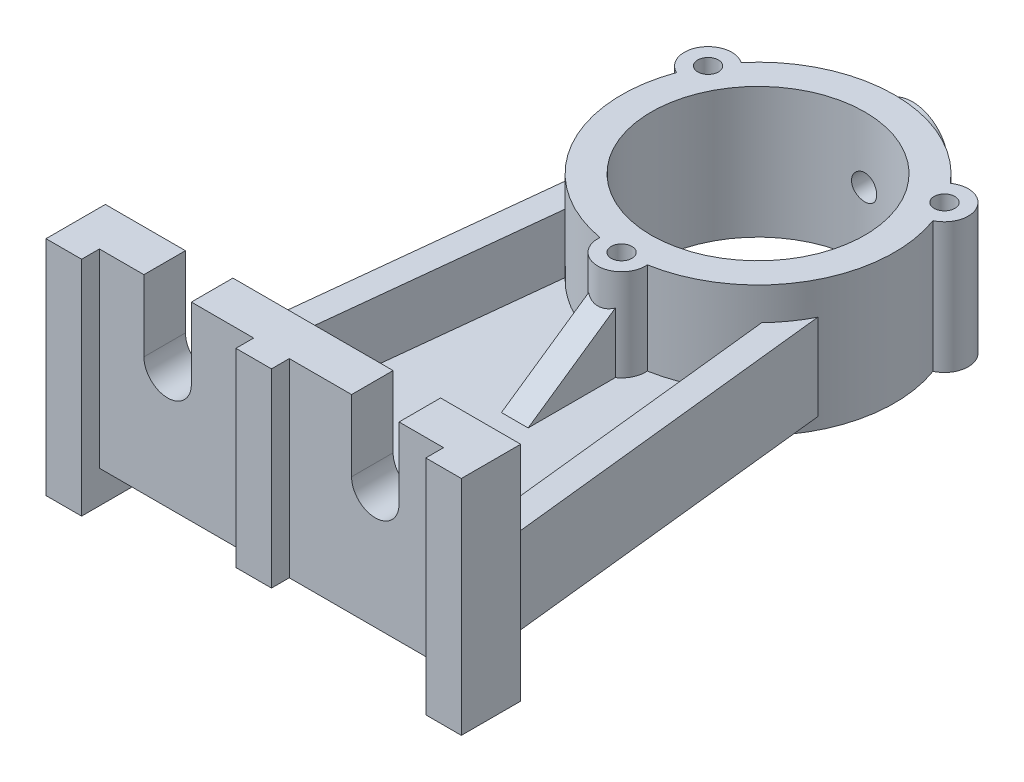
from build123d import *

# Parameters (mm, degrees)
SKETCH_1_R               = 46
EXTRUDE_1_DEPTH          = 44
SKETCH_2_R               = 8
EXTRUDE_2_DEPTH          = 44
SKETCH_3_R               = 3.5
CUT_EXTRUDE_1_DEPTH      = 44
PATTERN_CIRCULAR_1_COUNT = 3
EXTRUDE_START            = -52
EXTRUDE_3_DEPTH          = 44
SKETCH_6_R               = 36
CUT_EXTRUDE_2_DEPTH      = 44
HOLE_WIZARD_M10_1_REACH  = 126.34
HOLE_WIZARD_M10_1_BORE_R = 4.25
EXTRUDE_START_2          = 4
EXTRUDE_4_DEPTH          = 9
EXTRUDE_5_DEPTH          = 20
RIB_1_REACH              = 167.714
SKETCH_11_WALL_W         = 368.62723947
SKETCH_11_WALL_H         = 9
EXTRUDE_START_3          = 170
SKETCH_13_W              = 140
SKETCH_13_H              = 64
EXTRUDE_6_DEPTH          = 20
CUT_EXTRUDE_3_DEPTH      = 227.559043166
SKETCH_15_W              = 52
SKETCH_15_H              = 6
CUT_EXTRUDE_4_DEPTH      = 199.557296554
SKETCH_17_W              = 12
SKETCH_17_H              = 20
EXTRUDE_7_DEPTH          = 11


with BuildPart() as part:
    # 草图1 → 凸台-拉伸1 (new body)
    with BuildSketch(Plane(origin=(0, 0, 0), x_dir=(1, 0, 0), z_dir=(0, 1, 0))):
        with Locations(Location((0, 0, 0), (0, 0, 270))):
            Circle(SKETCH_1_R)
    extrude(amount=EXTRUDE_1_DEPTH)

    # 草图2 → 凸台-拉伸2 (add)
    with BuildSketch(Plane(origin=(0, 44, 0), x_dir=(1, 0, 0), z_dir=(0, 1, 0))):
        with Locations((0, -46)):
            Circle(SKETCH_2_R)
    extrude_2 = extrude(amount=-EXTRUDE_2_DEPTH)

    # 草图3 → 切除-拉伸1 (cut)
    with BuildSketch(Plane(origin=(0, 44, 0), x_dir=(1, 0, 0), z_dir=(0, 1, 0))):
        with Locations(Location((0, -46, 0), (0, 0, 270))):
            Circle(SKETCH_3_R)
    cut_extrude_1 = extrude(amount=-CUT_EXTRUDE_1_DEPTH, mode=Mode.SUBTRACT)

    # 阵列(圆周)1: 凸台-拉伸2, 切除-拉伸1 ×3 about axis
    pattern_circular_1_axis = Axis((0, 0, 0), (0, 1, 0))
    add([extrude_2.rotate(pattern_circular_1_axis, i * 360 / PATTERN_CIRCULAR_1_COUNT) for i in range(1, PATTERN_CIRCULAR_1_COUNT)])
    add([cut_extrude_1.rotate(pattern_circular_1_axis, i * 360 / PATTERN_CIRCULAR_1_COUNT) for i in range(1, PATTERN_CIRCULAR_1_COUNT)], mode=Mode.SUBTRACT)

    # 草图5 → 凸台-拉伸3 (add)
    with BuildSketch(Plane.XY.offset(EXTRUDE_START)):
        with BuildLine():
            Line((-12, 27), (-12, 0))
            Line((-12, 0), (12, 0))
            Line((12, 0), (12, 27))
            ThreePointArc((12, 27), (0, 39), (-12, 27))
        make_face()
    extrude(amount=EXTRUDE_3_DEPTH)

    # 草图6 → 切除-拉伸2 (cut)
    with BuildSketch(Plane(origin=(0, 44, 0), x_dir=(1, 0, 0), z_dir=(0, 1, 0))):
        with Locations(Location((0, 0, 0), (0, 0, 270))):
            Circle(SKETCH_6_R)
    extrude(amount=-CUT_EXTRUDE_2_DEPTH, mode=Mode.SUBTRACT)

    # M10 螺纹孔1 bore → M10 螺纹孔1 (cut, up to next)
    with BuildSketch(Plane(origin=(0, 0, -52), x_dir=(-1, 0, 0), z_dir=(0, 0, -1)), mode=Mode.PRIVATE) as hole_wizard_m10_1_sk1:
        with Locations((0, 22)):
            Circle(HOLE_WIZARD_M10_1_BORE_R)
    hole_wizard_m10_1_tool1 = extrude(hole_wizard_m10_1_sk1.sketch, amount=-HOLE_WIZARD_M10_1_REACH, mode=Mode.PRIVATE) & part.part
    add(hole_wizard_m10_1_tool1.solids().sort_by_distance((0, 22, -52))[0], mode=Mode.SUBTRACT)

    # 草图9 → 凸台-拉伸4 (add)
    with BuildSketch(Plane(origin=(0, 0, 0), x_dir=(1, 0, 0), z_dir=(0, 1, 0)).offset(EXTRUDE_START_2)):
        with BuildLine():
            Line((-41, -20.856653615), (-55, -150))
            Line((-55, -150), (55, -150))
            Line((55, -150), (41, -20.856653615))
            ThreePointArc((41, -20.856653615), (27.366589863, -36.973906465), (7.969696861, -45.304347826))
            ThreePointArc((7.969696861, -45.304347826), (0, -54), (-7.969696861, -45.304347826))
            ThreePointArc((-7.969696861, -45.304347826), (-27.366589863, -36.973906465), (-41, -20.856653615))
        make_face()
    extrude(amount=EXTRUDE_4_DEPTH)

    # 草图10 → 凸台-拉伸5 (add)
    with BuildSketch(Plane(origin=(0, 13, 0), x_dir=(1, 0, 0), z_dir=(0, 1, 0))):
        with BuildLine():
            Line((45.947270441, -150), (33.144192236, -31.897688333))
            ThreePointArc((33.144192236, -31.897688333), (37.480880759, -26.668025377), (41, -20.856653615))
            Line((41, -20.856653615), (55, -150))
            Line((55, -150), (45.947270441, -150))
        make_face()
        with BuildLine():
            Line((-33.144192236, -31.897688333), (-45.947270441, -150))
            Line((-45.947270441, -150), (-55, -150))
            Line((-55, -150), (-41, -20.856653615))
            ThreePointArc((-41, -20.856653615), (-37.480880759, -26.668025377), (-33.144192236, -31.897688333))
        make_face()
    extrude(amount=EXTRUDE_5_DEPTH)

    # 草图11 wall → 筋1 (add, up to next)
    with BuildSketch(Plane(origin=(0, 23, 67.516892633), x_dir=(0, -0.568181452229, 0.822903297686), z_dir=(0, -0.822903297686, -0.568181452229)), mode=Mode.PRIVATE) as rib_1_sk1:
        Rectangle(SKETCH_11_WALL_W, SKETCH_11_WALL_H)
    rib_1_tool1 = extrude(rib_1_sk1.sketch, amount=RIB_1_REACH, mode=Mode.PRIVATE) - part.part
    add(rib_1_tool1.solids().sort_by_distance((0, 23, 67.516892633))[0])

    # 草图13 → 凸台-拉伸6 (add)
    with BuildSketch(Plane.XY.offset(EXTRUDE_START_3)):
        with Locations((0, 43)):
            Rectangle(SKETCH_13_W, SKETCH_13_H)
    extrude(amount=-EXTRUDE_6_DEPTH)

    # 草图14 → 切除-拉伸3 (cut, through all)
    with BuildSketch(Plane(origin=(0, 0, 150), x_dir=(-1, 0, 0), z_dir=(0, 0, -1))):
        with BuildLine():
            Line((43, 75), (43, 51))
            ThreePointArc((43, 51), (35, 43), (27, 51))
            Line((27, 51), (27, 75))
            ThreePointArc((27, 75), (35, 83), (43, 75))
        make_face()
    cut_extrude_3 = extrude(amount=-CUT_EXTRUDE_3_DEPTH, mode=Mode.SUBTRACT)

    # 镜向1: 切除-拉伸3 across plane
    add(cut_extrude_3.mirror(Plane(origin=(0, 0, 0), x_dir=(0, 0, 1), z_dir=(1, 0, 0))), mode=Mode.SUBTRACT)

    # 草图15 → 切除-拉伸4 (cut, through all)
    with BuildSketch(Plane(origin=(0, 75, 0), x_dir=(1, 0, 0), z_dir=(0, 1, 0))):
        with Locations((-32, -167)):
            Rectangle(SKETCH_15_W, SKETCH_15_H)
    cut_extrude_4 = extrude(amount=-CUT_EXTRUDE_4_DEPTH, mode=Mode.SUBTRACT)

    # 镜向2: 切除-拉伸4 across plane
    add(cut_extrude_4.mirror(Plane(origin=(0, 0, 0), x_dir=(0, 0, 1), z_dir=(1, 0, 0))), mode=Mode.SUBTRACT)

    # 草图17 → 凸台-拉伸7 (add)
    with BuildSketch(Plane.XZ.offset(-11)):
        with Locations((-64, 160)):
            Rectangle(SKETCH_17_W, SKETCH_17_H)
    extrude_7 = extrude(amount=EXTRUDE_7_DEPTH)

    # 镜向3: 凸台-拉伸7 across plane
    add(extrude_7.mirror(Plane(origin=(0, 0, 0), x_dir=(0, 0, 1), z_dir=(1, 0, 0))))


solid = part.part
